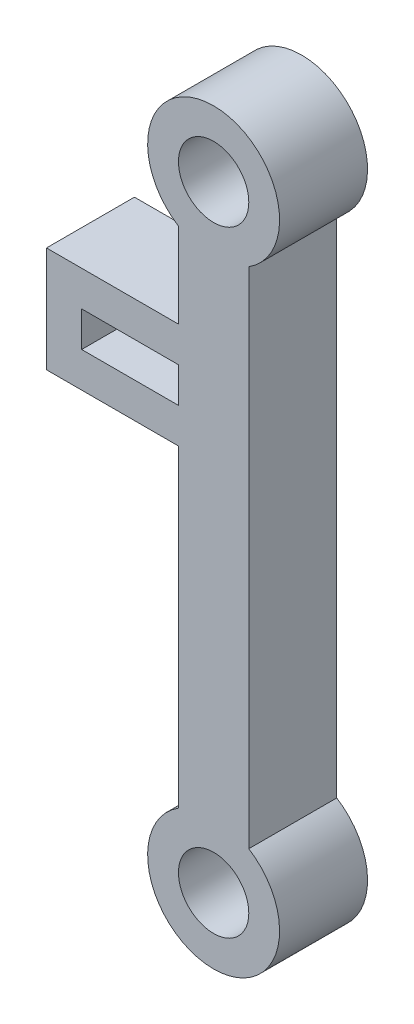
from build123d import *

# Parameters (mm, degrees)
ESBO_O1_R                = 4
ESBO_O1_W                = 11
ESBO_O1_H                = 4
RESSALTO_EXTRUS_O1_DEPTH = 10


with BuildPart() as part:
    # Esboço1 → Ressalto-extrusão1 (new body)
    with BuildSketch(Plane.XY):
        with BuildLine():
            Line((4, 6.34428877), (4, 63.65571123))
            ThreePointArc((4, 63.65571123), (0, 77.5), (-4, 63.65571123))
            Line((-4, 63.65571123), (-4, 54))
            Line((-4, 54), (-19, 54))
            Line((-19, 54), (-19, 42))
            Line((-19, 42), (-4, 42))
            Line((-4, 42), (-4, 6.34428877))
            ThreePointArc((-4, 6.34428877), (0, -7.5), (4, 6.34428877))
        make_face()
        Circle(ESBO_O1_R, mode=Mode.SUBTRACT)
        with Locations((-9.5, 48)):
            Rectangle(ESBO_O1_W, ESBO_O1_H, mode=Mode.SUBTRACT)
        with Locations((0, 70)):
            Circle(ESBO_O1_R, mode=Mode.SUBTRACT)
    extrude(amount=RESSALTO_EXTRUS_O1_DEPTH)


solid = part.part
